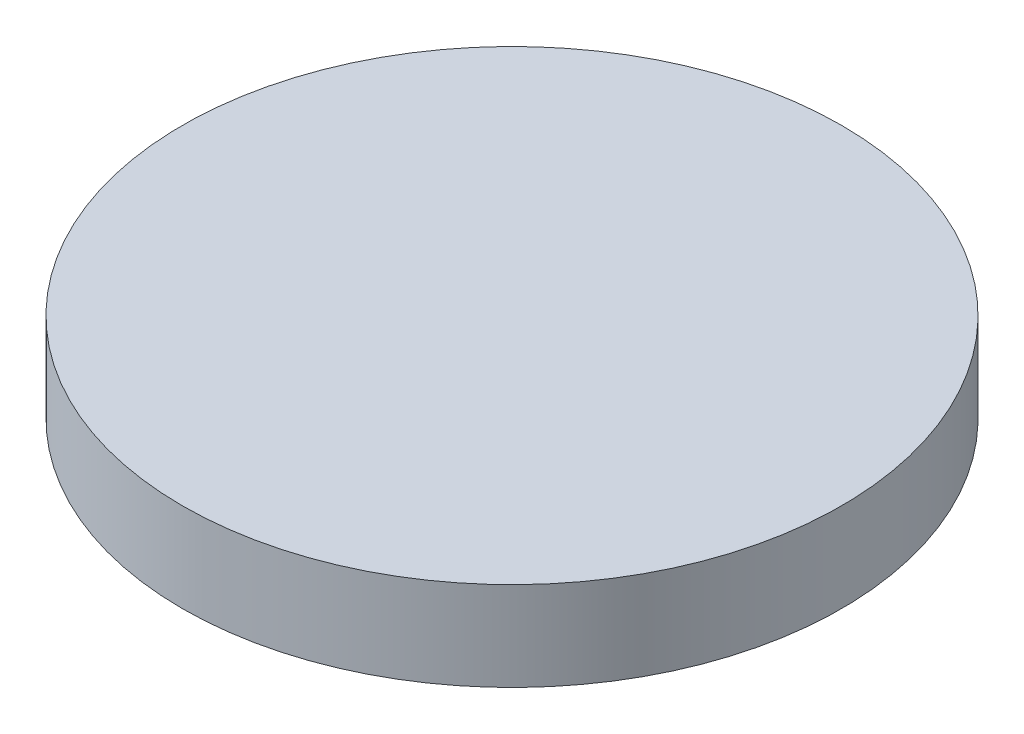
from build123d import *

# Parameters (mm, degrees)
SKETCH1_R           = 3.7
BOSS_EXTRUDE1_DEPTH = 1


with BuildPart() as part:
    # Sketch1 → Boss-Extrude1 (new body)
    with BuildSketch(Plane(origin=(0, 0, 0), x_dir=(1, 0, 0), z_dir=(0, 1, 0))):
        with Locations(Location((0, 0, 0), (0, 0, 270))):
            Circle(SKETCH1_R)
    extrude(amount=BOSS_EXTRUDE1_DEPTH)


solid = part.part
